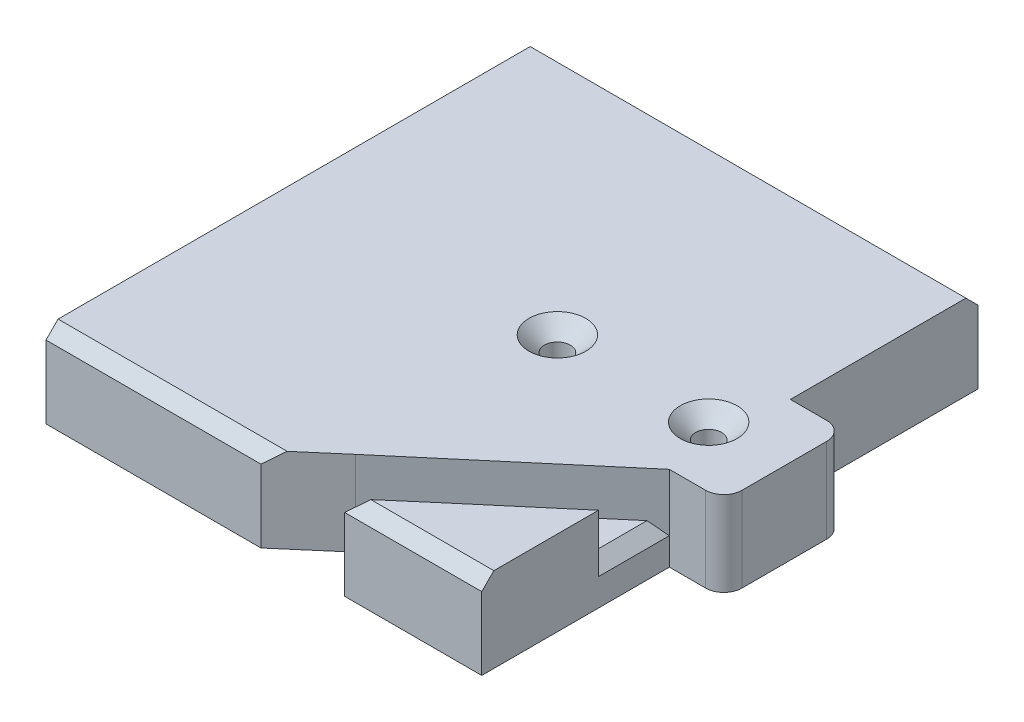
from build123d import *

# Parameters (mm, degrees)
ESQUISSE2_W                                    = 72
ESQUISSE2_H                                    = 14
BOSS_EXTRU_1_DEPTH                             = 41
ESQUISSE12_W                                   = 9
ESQUISSE12_H                                   = 20
BOSS_EXTRU_6_DEPTH                             = 14
FRAISAGE_POUR_VIS_T_TE_FRAIS_E_M41_D           = 4.3
FRAISAGE_POUR_VIS_T_TE_FRAIS_E_M41_CSINK_D     = 9.4
FRAISAGE_POUR_VIS_T_TE_FRAIS_E_M41_CSINK_ANGLE = 90
ENL_V_MAT_EXTRU_3_REACH                        = 95.798
ESQUISSE6_W                                    = 20
ESQUISSE6_H                                    = 10
ESQUISSE5_W                                    = 5.5
ESQUISSE5_H                                    = 50
ENL_V_MAT_EXTRU_2_DEPTH                        = 7
CHANFREIN1_SIZE                                = 2
ESQUISSE16_W                                   = 20
ESQUISSE16_H                                   = 7
BOSS_EXTRU_7_DEPTH                             = 10
ENL_V_START                                    = -14
ENL_V_MAT_EXTRU_4_DEPTH                        = 14
ENL_V_MAT_EXTRU_5_DEPTH                        = 7.5
CHANFREIN2_SIZE                                = 2
CONG_3_R                                       = 3


with BuildPart() as part:
    # Esquisse2 → Boss.-Extru.1 (new, symmetric)
    with BuildSketch(Plane.XY):
        Rectangle(ESQUISSE2_W, ESQUISSE2_H)
    extrude(amount=BOSS_EXTRU_1_DEPTH, both=True)

    # Esquisse12 → Boss.-Extru.6 (add)
    with BuildSketch(Plane(origin=(0, 7, 0), x_dir=(1, 0, 0), z_dir=(0, 1, 0))):
        with Locations((40.5, 0)):
            Rectangle(ESQUISSE12_W, ESQUISSE12_H)
    extrude(amount=-BOSS_EXTRU_6_DEPTH)

    # Fraisage pour vis à tête fraisée M41 (through all)
    with Locations(Plane(origin=(0, 7, 0), x_dir=(1, 0, 0), z_dir=(0, 1, 0))):
        with Locations((32.5, 0), (7.5, 0)):
            CounterSinkHole(FRAISAGE_POUR_VIS_T_TE_FRAIS_E_M41_D / 2, FRAISAGE_POUR_VIS_T_TE_FRAIS_E_M41_CSINK_D / 2, counter_sink_angle=FRAISAGE_POUR_VIS_T_TE_FRAIS_E_M41_CSINK_ANGLE)

    # Esquisse6 → Enlèv. mat.-Extru.3 (cut, up to next)
    with BuildSketch(Plane.XY.offset(41), mode=Mode.PRIVATE) as enl_v_mat_extru_3_sk1:
        with Locations((-18, -2)):
            Rectangle(ESQUISSE6_W, ESQUISSE6_H)
    enl_v_mat_extru_3_tool1 = extrude(enl_v_mat_extru_3_sk1.sketch, amount=-ENL_V_MAT_EXTRU_3_REACH, mode=Mode.PRIVATE) & part.part
    add(enl_v_mat_extru_3_tool1.solids().sort_by_distance((-18, -2, 41))[0], mode=Mode.SUBTRACT)

    # Esquisse5 → Enlèv. mat.-Extru.2 (cut)
    with BuildSketch(Plane(origin=(0, -7, 0), x_dir=(1, 0, 0), z_dir=(0, 1, 0))):
        with Locations((-33.25, 0)):
            Rectangle(ESQUISSE5_W, ESQUISSE5_H)
    extrude(amount=ENL_V_MAT_EXTRU_2_DEPTH, mode=Mode.SUBTRACT)

    # Chanfrein1
    chanfrein1_edges = [part.edges().sort_by_distance(p)[0] for p in [
        (0, 7, -41),
        (0, 7, 41),
    ]]
    chamfer(chanfrein1_edges, length=CHANFREIN1_SIZE)

    # Esquisse16 → Boss.-Extru.7 (add)
    with BuildSketch(Plane.XZ.offset(-3)):
        with Locations((-18, -37.5)):
            Rectangle(ESQUISSE16_W, ESQUISSE16_H)
    boss_extru_7 = extrude(amount=BOSS_EXTRU_7_DEPTH)

    # Symétrie1: Boss.-Extru.7 across plane
    add(boss_extru_7.mirror(Plane.XY))

    # Esquisse17 → Enlèv. mat.-Extru.4 (cut)
    with BuildSketch(Plane(origin=(0, 7, 0), x_dir=(1, 0, 0), z_dir=(0, 1, 0)).offset(ENL_V_START)):
        Polygon((13.342024655, -41), (21.739180223, -33.8), (7.912562911, -33.8), (-0.484592656, -41), align=None)
    extrude(amount=ENL_V_MAT_EXTRU_4_DEPTH, mode=Mode.SUBTRACT)

    # Esquisse18 → Enlèv. mat.-Extru.5 (cut)
    with BuildSketch(Plane(origin=(0, 7, 0), x_dir=(1, 0, 0), z_dir=(0, 1, 0))):
        Polygon((7.912562911, -33.8), (36, -10), (36, -21.716038419), (21.739180223, -33.8), align=None)
    extrude(amount=-ENL_V_MAT_EXTRU_5_DEPTH, mode=Mode.SUBTRACT)

    # Chanfrein2
    chanfrein2_edges = [part.edges().sort_by_distance(p)[0] for p in [
        (14.825871567, -0.5, 33.8),
        (36, -0.5, 15.858019209),
    ]]
    chamfer(chanfrein2_edges, length=CHANFREIN2_SIZE)

    # Congé3
    cong_3_edges = [part.edges().sort_by_distance(p)[0] for p in [
        (45, 0, 10),
        (45, 0, -10),
    ]]
    fillet(cong_3_edges, radius=CONG_3_R)


solid = part.part
